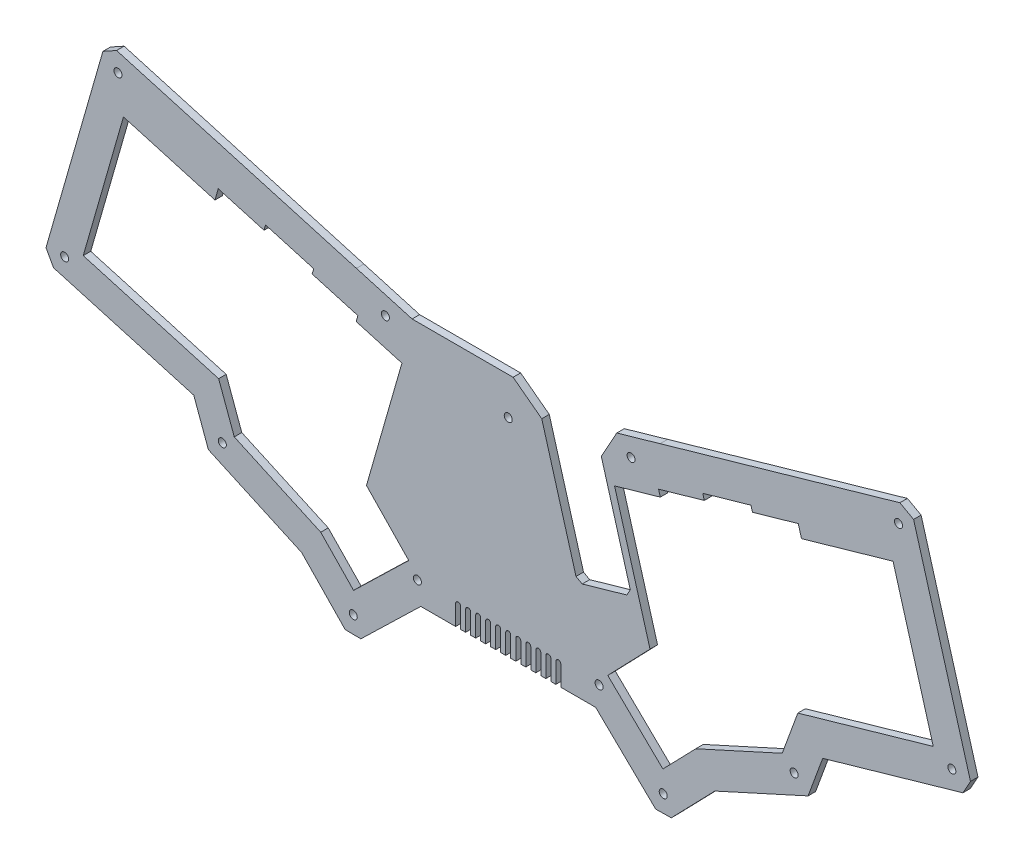
from build123d import *

# Parameters (mm, degrees)
ESQUISSE1_R             = 1.6
BOSS_EXTRU_1_DEPTH      = 3
ENL_V_MAT_EXTRU_1_DEPTH = 10


with BuildPart() as part:
    # Esquisse1 → Boss.-Extru.1 (new body)
    with BuildSketch(Plane.XY):
        Polygon((-119.070790786, -62.796362516), (-130.649820486, -22.415487094), (-124.479201425, -11.283395628), (-113.904378452, -8.251113935), (-107.178924408, -6.322621021), (-11.444293109, 21.123080509), (-5.984240232, 18.096325283), (16.733855492, -61.131089881), (13.707363231, -66.591026451), (-42.255771499, -82.638197107), (-48.091810819, -98.561018129), (-85.310364869, -115.48724507), (-102.69792658, -133.444615579), (-108.937044092, -133.542771169), (-132.888887149, -110.350948678), (-202.701632594, -110.350948678), (-226.653475651, -133.542771169), (-232.892593163, -133.444615579), (-250.280154874, -115.48724507), (-287.498708924, -98.561018129), (-293.334748244, -82.638197107), (-349.297882974, -66.591026451), (-352.324375235, -61.131089881), (-329.606279511, 18.096325283), (-324.146226634, 21.123080509), (-228.411595335, -6.322621021), (-221.686141291, -8.251113935), (-206.165691337, -12.701531345), (-165.848732708, -12.701531345), (-154.419403971, -21.314148304), (-140.742647218, -69.010667349), (-138.268849115, -70.381916029), (-120.442039466, -65.27016062), align=None)
        with Locations((-12.000450916, 13.68165837)):
            Circle(ESQUISSE1_R, mode=Mode.SUBTRACT)
        with Locations((-118.757933777, -16.924131519)):
            Circle(ESQUISSE1_R, mode=Mode.SUBTRACT)
        with Locations((9.292284284, -60.574933915)):
            Circle(ESQUISSE1_R, mode=Mode.SUBTRACT)
        with Locations((-53.656180266, -93.401689518)):
            Circle(ESQUISSE1_R, mode=Mode.SUBTRACT)
        with Locations((-105.923928137, -126.713325795)):
            Circle(ESQUISSE1_R, mode=Mode.SUBTRACT)
        with Locations((-131.530967037, -101.880200807)):
            Circle(ESQUISSE1_R, mode=Mode.SUBTRACT)
        with Locations((-204.059552706, -101.880200807)):
            Circle(ESQUISSE1_R, mode=Mode.SUBTRACT)
        with Locations((-229.666591606, -126.713325795)):
            Circle(ESQUISSE1_R, mode=Mode.SUBTRACT)
        with Locations((-281.934339477, -93.401689518)):
            Circle(ESQUISSE1_R, mode=Mode.SUBTRACT)
        with Locations((-344.882804027, -60.574933915)):
            Circle(ESQUISSE1_R, mode=Mode.SUBTRACT)
        with Locations((-216.832585966, -16.924131519)):
            Circle(ESQUISSE1_R, mode=Mode.SUBTRACT)
        with Locations((-323.590068827, 13.68165837)):
            Circle(ESQUISSE1_R, mode=Mode.SUBTRACT)
        with Locations((-167.795259872, -27.605548894)):
            Circle(ESQUISSE1_R, mode=Mode.SUBTRACT)
        Polygon((-128.0696158, -96.878899722), (-106.057456456, -118.225792128), (-92.935433745, -104.673746846), (-58.425639792, -88.979407851), (-52.188593581, -71.96249534), (1.870889973, -56.461187875), (-14.186085737, -0.463858857), (-50.716621092, -10.938821309), (-52.025991399, -6.372504389), (-70.291259076, -11.609985616), (-70.910965859, -9.448811229), (-90.137733677, -14.960840928), (-89.517720268, -17.123084647), (-107.782987945, -22.360565873), (-107.093845678, -24.763890567), (-125.358331696, -30.001147656), (-111.200088958, -79.377961929), (-127.377713529, -96.161100182), align=None, mode=Mode.SUBTRACT)
        Polygon((-224.390430785, -79.377961929), (-208.212806214, -96.161100182), (-207.491865187, -96.85509979), (-208.236606037, -97.572971364), (-229.533063287, -118.225792128), (-242.655085998, -104.673746846), (-277.164879951, -88.979407851), (-283.401926162, -71.96249534), (-337.461409717, -56.461187875), (-321.404434006, -0.463858857), (-284.873898651, -10.938821309), (-283.564528345, -6.372504389), (-265.299260667, -11.609985616), (-264.679553884, -9.448811229), (-245.452786066, -14.960840928), (-246.072799476, -17.123084647), (-227.807531798, -22.360565873), (-228.496674065, -24.763890567), (-210.232188047, -30.001147656), align=None, mode=Mode.SUBTRACT)
    extrude(amount=BOSS_EXTRU_1_DEPTH)

    # Esquisse2 → Enlèv. mat.-Extru.1 (cut)
    with BuildSketch(Plane.XY.offset(3)):
        with BuildLine():
            Line((-168.795259872, -110.350948678), (-168.795259872, -102.350948678))
            ThreePointArc((-168.795259872, -102.350948678), (-167.795259872, -101.350948678), (-166.795259872, -102.350948678))
            Line((-166.795259872, -102.350948678), (-166.795259872, -110.350948678))
            ThreePointArc((-166.795259872, -110.350948678), (-167.795259872, -111.350948678), (-168.795259872, -110.350948678))
        make_face()
        with BuildLine():
            Line((-164.795259872, -110.350948678), (-164.795259872, -102.350948678))
            ThreePointArc((-164.795259872, -102.350948678), (-163.795259872, -101.350948678), (-162.795259872, -102.350948678))
            Line((-162.795259872, -102.350948678), (-162.795259872, -110.350948678))
            ThreePointArc((-162.795259872, -110.350948678), (-163.795259872, -111.350948678), (-164.795259872, -110.350948678))
        make_face()
        with BuildLine():
            Line((-160.795259872, -110.350948678), (-160.795259872, -102.350948678))
            ThreePointArc((-160.795259872, -102.350948678), (-159.795259872, -101.350948678), (-158.795259872, -102.350948678))
            Line((-158.795259872, -102.350948678), (-158.795259872, -110.350948678))
            ThreePointArc((-158.795259872, -110.350948678), (-159.795259872, -111.350948678), (-160.795259872, -110.350948678))
        make_face()
        with BuildLine():
            Line((-156.795259872, -110.350948678), (-156.795259872, -102.350948678))
            ThreePointArc((-156.795259872, -102.350948678), (-155.795259872, -101.350948678), (-154.795259872, -102.350948678))
            Line((-154.795259872, -102.350948678), (-154.795259872, -110.350948678))
            ThreePointArc((-154.795259872, -110.350948678), (-155.795259872, -111.350948678), (-156.795259872, -110.350948678))
        make_face()
        with BuildLine():
            Line((-152.795259872, -110.350948678), (-152.795259872, -102.350948678))
            ThreePointArc((-152.795259872, -102.350948678), (-151.795259872, -101.350948678), (-150.795259872, -102.350948678))
            Line((-150.795259872, -102.350948678), (-150.795259872, -110.350948678))
            ThreePointArc((-150.795259872, -110.350948678), (-151.795259872, -111.350948678), (-152.795259872, -110.350948678))
        make_face()
        with BuildLine():
            Line((-148.795259872, -110.350948678), (-148.795259872, -102.350948678))
            ThreePointArc((-148.795259872, -102.350948678), (-147.795259872, -101.350948678), (-146.795259872, -102.350948678))
            Line((-146.795259872, -102.350948678), (-146.795259872, -110.350948678))
            ThreePointArc((-146.795259872, -110.350948678), (-147.795259872, -111.350948678), (-148.795259872, -110.350948678))
        make_face()
        with BuildLine():
            Line((-172.795259872, -110.350948678), (-172.795259872, -102.350948678))
            ThreePointArc((-172.795259872, -102.350948678), (-171.795259872, -101.350948678), (-170.795259872, -102.350948678))
            Line((-170.795259872, -102.350948678), (-170.795259872, -110.350948678))
            ThreePointArc((-170.795259872, -110.350948678), (-171.795259872, -111.350948678), (-172.795259872, -110.350948678))
        make_face()
        with BuildLine():
            Line((-176.795259872, -110.350948678), (-176.795259872, -102.350948678))
            ThreePointArc((-176.795259872, -102.350948678), (-175.795259872, -101.350948678), (-174.795259872, -102.350948678))
            Line((-174.795259872, -102.350948678), (-174.795259872, -110.350948678))
            ThreePointArc((-174.795259872, -110.350948678), (-175.795259872, -111.350948678), (-176.795259872, -110.350948678))
        make_face()
        with BuildLine():
            Line((-180.795259872, -110.350948678), (-180.795259872, -102.350948678))
            ThreePointArc((-180.795259872, -102.350948678), (-179.795259872, -101.350948678), (-178.795259872, -102.350948678))
            Line((-178.795259872, -102.350948678), (-178.795259872, -110.350948678))
            ThreePointArc((-178.795259872, -110.350948678), (-179.795259872, -111.350948678), (-180.795259872, -110.350948678))
        make_face()
        with BuildLine():
            Line((-184.795259872, -110.350948678), (-184.795259872, -102.350948678))
            ThreePointArc((-184.795259872, -102.350948678), (-183.795259872, -101.350948678), (-182.795259872, -102.350948678))
            Line((-182.795259872, -102.350948678), (-182.795259872, -110.350948678))
            ThreePointArc((-182.795259872, -110.350948678), (-183.795259872, -111.350948678), (-184.795259872, -110.350948678))
        make_face()
        with BuildLine():
            Line((-188.795259872, -110.350948678), (-188.795259872, -102.350948678))
            ThreePointArc((-188.795259872, -102.350948678), (-187.795259872, -101.350948678), (-186.795259872, -102.350948678))
            Line((-186.795259872, -102.350948678), (-186.795259872, -110.350948678))
            ThreePointArc((-186.795259872, -110.350948678), (-187.795259872, -111.350948678), (-188.795259872, -110.350948678))
        make_face()
    extrude(amount=-ENL_V_MAT_EXTRU_1_DEPTH, mode=Mode.SUBTRACT)


solid = part.part
